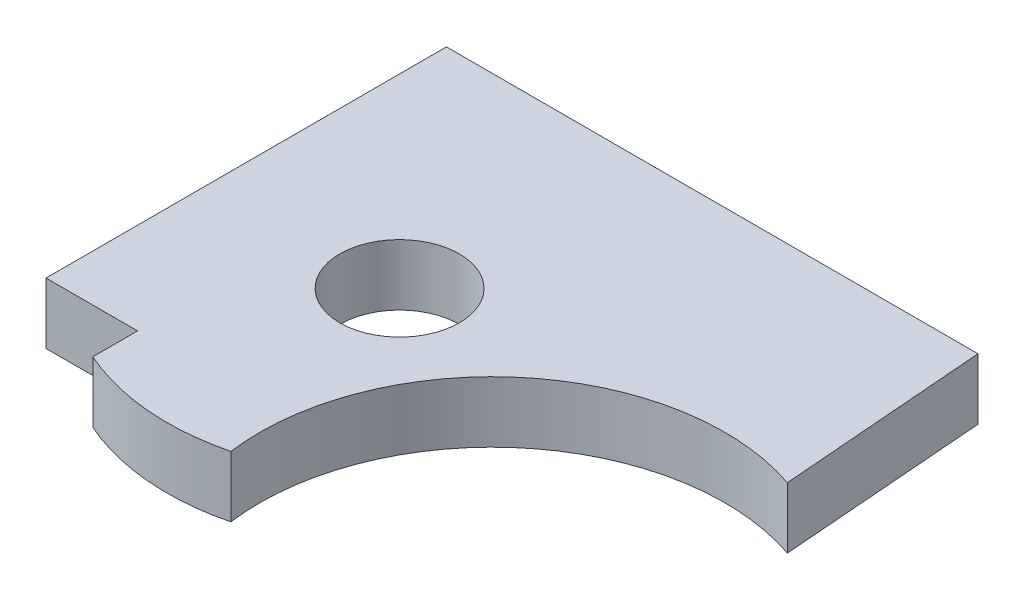
from build123d import *

# Parameters (mm, degrees)
SKETCH1_R           = 3.915
BOSS_EXTRUDE1_DEPTH = 4


with BuildPart() as part:
    # Sketch1 → Boss-Extrude1 (new body)
    with BuildSketch(Plane(origin=(0, 0, 0), x_dir=(1, 0, 0), z_dir=(0, 1, 0))):
        with BuildLine():
            Line((112.296761578, 6.055177331), (112.296761578, 3.119444466))
            ThreePointArc((112.296761578, 3.119444466), (117.173733569, 1.869604275), (122.191807827, 2.276896615))
            ThreePointArc((122.191807827, 2.276896615), (127.614961562, 16.075321721), (142.200280719, 18.735321146))
            Line((142.200280719, 18.735321146), (141.13131283, 32.295700632))
            Line((141.13131283, 32.295700632), (106.296761578, 32.295700632))
            Line((106.296761578, 32.295700632), (106.296761578, 6.055177331))
            Line((106.296761578, 6.055177331), (112.296761578, 6.055177331))
        make_face()
        with Locations((118.466761578, 17.055177331)):
            Circle(SKETCH1_R, mode=Mode.SUBTRACT)
    extrude(amount=BOSS_EXTRUDE1_DEPTH)


solid = part.part
